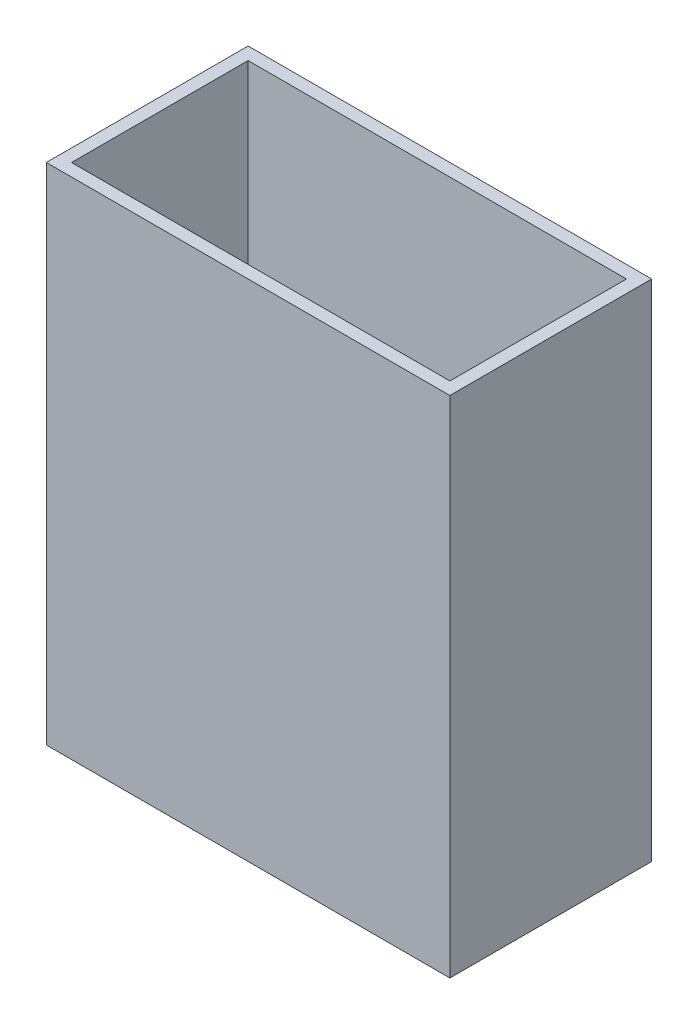
from build123d import *

# Parameters (mm, degrees)
SKETCH1_W           = 160
SKETCH1_H           = 80
BOSS_EXTRUDE1_DEPTH = 225
SKETCH2_W           = 150
SKETCH2_H           = 70
CUT_EXTRUDE1_DEPTH  = 220
SKETCH7_W           = 2
SKETCH7_H           = 120
BOSS_EXTRUDE2_DEPTH = 5
SKETCH8_W           = 2
SKETCH8_H           = 120
BOSS_EXTRUDE3_DEPTH = 5
SKETCH9_W           = 2
SKETCH9_H           = 120
BOSS_EXTRUDE4_DEPTH = 5
SKETCH10_W          = 2
SKETCH10_H          = 120
BOSS_EXTRUDE5_DEPTH = 5
SKETCH11_W          = 160
SKETCH11_H          = 80
SKETCH11_W_2        = 150
SKETCH11_H_2        = 70
CUT_EXTRUDE2_DEPTH  = 25


with BuildPart() as part:
    # Sketch1 → Boss-Extrude1 (new body)
    with BuildSketch(Plane(origin=(0, 0, 0), x_dir=(1, 0, 0), z_dir=(0, 1, 0))):
        Rectangle(SKETCH1_W, SKETCH1_H)
    extrude(amount=BOSS_EXTRUDE1_DEPTH)

    # Sketch2 → Cut-Extrude1 (cut)
    with BuildSketch(Plane(origin=(0, 225, 0), x_dir=(1, 0, 0), z_dir=(0, 1, 0))):
        Rectangle(SKETCH2_W, SKETCH2_H)
    extrude(amount=-CUT_EXTRUDE1_DEPTH, mode=Mode.SUBTRACT)

    # Sketch7 → Boss-Extrude2 (add)
    with BuildSketch(Plane(origin=(0, 0, 35), x_dir=(-1, 0, 0), z_dir=(0, 0, -1))):
        with Locations((-39.5, 65)):
            Rectangle(SKETCH7_W, SKETCH7_H)
        with Locations((-35.5, 65)):
            Rectangle(SKETCH7_W, SKETCH7_H)
        with Locations((-2, 65)):
            Rectangle(SKETCH7_W, SKETCH7_H)
        with Locations((2, 65)):
            Rectangle(SKETCH7_W, SKETCH7_H)
        with Locations((35.5, 65)):
            Rectangle(SKETCH7_W, SKETCH7_H)
        with Locations((39.5, 65)):
            Rectangle(SKETCH7_W, SKETCH7_H)
    extrude(amount=BOSS_EXTRUDE2_DEPTH)

    # Sketch8 → Boss-Extrude3 (add)
    with BuildSketch(Plane.XY.offset(-35)):
        with Locations((-39.5, 65)):
            Rectangle(SKETCH8_W, SKETCH8_H)
        with Locations((-35.5, 65)):
            Rectangle(SKETCH8_W, SKETCH8_H)
        with Locations((-2, 65)):
            Rectangle(SKETCH8_W, SKETCH8_H)
        with Locations((2, 65)):
            Rectangle(SKETCH8_W, SKETCH8_H)
        with Locations((35.5, 65)):
            Rectangle(SKETCH8_W, SKETCH8_H)
        with Locations((39.5, 65)):
            Rectangle(SKETCH8_W, SKETCH8_H)
    extrude(amount=BOSS_EXTRUDE3_DEPTH)

    # Sketch9 → Boss-Extrude4 (add)
    with BuildSketch(Plane(origin=(-75, 0, 0), x_dir=(0, 0, -1), z_dir=(1, 0, 0))):
        with Locations((-2, 65)):
            Rectangle(SKETCH9_W, SKETCH9_H)
        with Locations((2, 65)):
            Rectangle(SKETCH9_W, SKETCH9_H)
    extrude(amount=BOSS_EXTRUDE4_DEPTH)

    # Sketch10 → Boss-Extrude5 (add)
    with BuildSketch(Plane.ZY.offset(-75)):
        with Locations((-2, 65)):
            Rectangle(SKETCH10_W, SKETCH10_H)
        with Locations((2, 65)):
            Rectangle(SKETCH10_W, SKETCH10_H)
    extrude(amount=BOSS_EXTRUDE5_DEPTH)

    # Sketch11 → Cut-Extrude2 (cut)
    with BuildSketch(Plane(origin=(0, 225, 0), x_dir=(1, 0, 0), z_dir=(0, 1, 0))):
        Rectangle(SKETCH11_W, SKETCH11_H)
        Rectangle(SKETCH11_W_2, SKETCH11_H_2, mode=Mode.SUBTRACT)
    extrude(amount=-CUT_EXTRUDE2_DEPTH, mode=Mode.SUBTRACT)


solid = part.part
